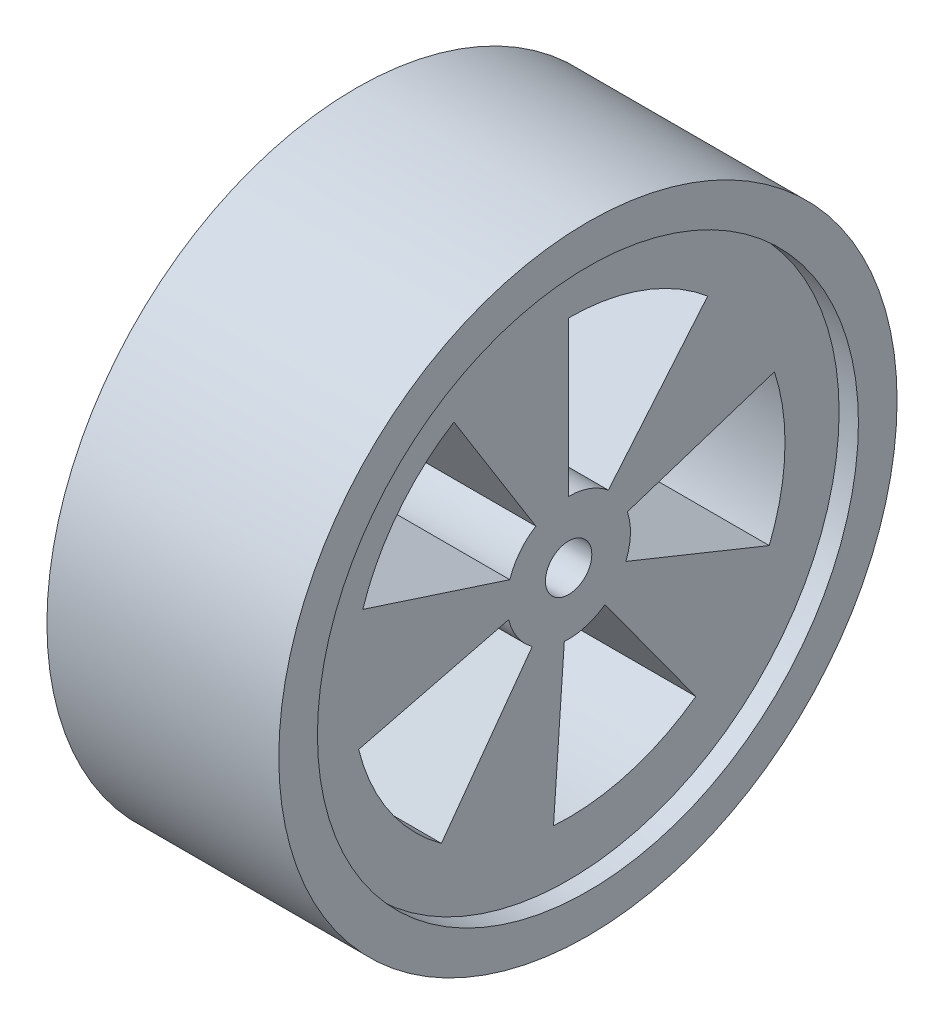
from build123d import *

# Parameters (mm, degrees)
SKETCH1_R           = 35
SKETCH1_R_2         = 3
BOSS_EXTRUDE1_DEPTH = 12.5
SKETCH2_R           = 40
SKETCH2_R_2         = 35
BOSS_EXTRUDE2_DEPTH = 15


with BuildPart() as part:
    # Sketch1 → Boss-Extrude1 (new, symmetric)
    with BuildSketch(Plane(origin=(0, 0, 0), x_dir=(0, 0, -1), z_dir=(1, 0, 0))):
        Circle(SKETCH1_R)
        Circle(SKETCH1_R_2, mode=Mode.SUBTRACT)
        with BuildLine():
            Line((0, 28), (0, 8))
            ThreePointArc((0, 8), (2.736161147, 7.517540966), (5.142300877, 6.128355545))
            Line((5.142300877, 6.128355545), (17.998053071, 21.449244407))
            ThreePointArc((17.998053071, 21.449244407), (9.576564013, 26.311393382), (0, 28))
        make_face(mode=Mode.SUBTRACT)
        with BuildLine():
            Line((26.629582456, 8.652475842), (7.60845213, 2.472135955))
            ThreePointArc((7.60845213, 2.472135955), (7.995126616, -0.279195974), (7.417470837, -2.996852747))
            Line((7.417470837, -2.996852747), (25.961147928, -10.488984616))
            ThreePointArc((25.961147928, -10.488984616), (27.982943157, -0.977185908), (26.629582456, 8.652475842))
        make_face(mode=Mode.SUBTRACT)
        with BuildLine():
            Line((16.457987064, -22.652475842), (4.702282018, -6.472135955))
            ThreePointArc((4.702282018, -6.472135955), (2.205098847, -7.690093568), (-0.55805179, -7.980512402))
            Line((-0.55805179, -7.980512402), (-1.953181265, -27.931793407))
            ThreePointArc((-1.953181265, -27.931793407), (7.717845963, -26.915327486), (16.457987064, -22.652475842))
        make_face(mode=Mode.SUBTRACT)
        with BuildLine():
            Line((-16.457987064, -22.652475842), (-4.702282018, -6.472135955))
            ThreePointArc((-4.702282018, -6.472135955), (-6.63230058, -4.473543228), (-7.76236581, -1.935375165))
            Line((-7.76236581, -1.935375165), (-27.168280336, -6.773813077))
            ThreePointArc((-27.168280336, -6.773813077), (-23.213052032, -15.657401297), (-16.457987064, -22.652475842))
        make_face(mode=Mode.SUBTRACT)
        with BuildLine():
            Line((-26.629582456, 8.652475842), (-7.60845213, 2.472135955))
            ThreePointArc((-7.60845213, 2.472135955), (-6.304086029, 4.925291803), (-4.239354114, 6.784384769))
            Line((-4.239354114, 6.784384769), (-14.837739399, 23.745346692))
            ThreePointArc((-14.837739399, 23.745346692), (-22.064301101, 17.238521309), (-26.629582456, 8.652475842))
        make_face(mode=Mode.SUBTRACT)
    extrude(amount=BOSS_EXTRUDE1_DEPTH, both=True)

    # Sketch2 → Boss-Extrude2 (add, symmetric)
    with BuildSketch(Plane(origin=(0, 0, 0), x_dir=(0, 0, -1), z_dir=(1, 0, 0))):
        Circle(SKETCH2_R)
        Circle(SKETCH2_R_2, mode=Mode.SUBTRACT)
    extrude(amount=BOSS_EXTRUDE2_DEPTH, both=True)


solid = part.part
